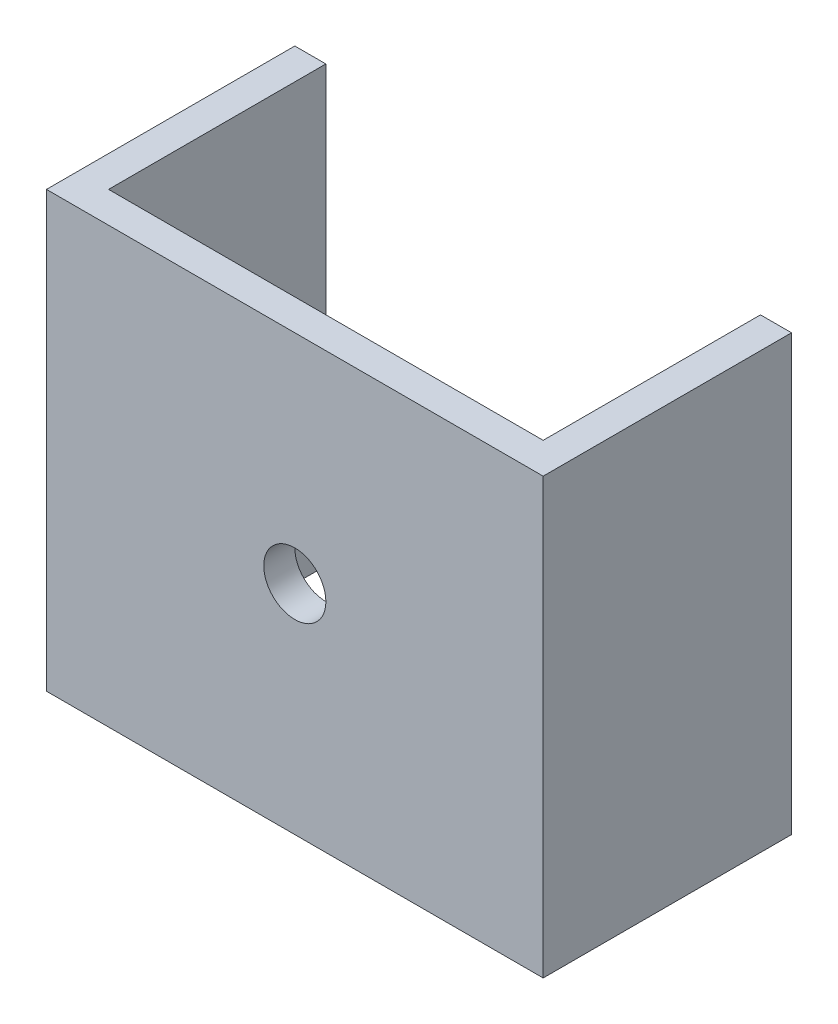
from build123d import *

# Parameters (mm, degrees)
BOSS_EXTRUDE1_DEPTH = 44.45
SKETCH2_R           = 3.175
CUT_EXTRUDE1_DEPTH  = 73.122135992


with BuildPart() as part:
    # Sketch1 → Boss-Extrude1 (new body)
    with BuildSketch(Plane(origin=(0, 0, 0), x_dir=(1, 0, 0), z_dir=(0, 1, 0))):
        Polygon((47.625, 25.4), (50.8, 25.4), (50.8, 0), (0, 0), (0, 25.4), (3.175, 25.4), (3.175, 3.175), (47.625, 3.175), align=None)
    extrude(amount=BOSS_EXTRUDE1_DEPTH)

    # Sketch2 → Cut-Extrude1 (cut, through all)
    with BuildSketch(Plane.XY):
        with Locations((25.4, 22.225)):
            Circle(SKETCH2_R)
    extrude(amount=-CUT_EXTRUDE1_DEPTH, mode=Mode.SUBTRACT)


solid = part.part
